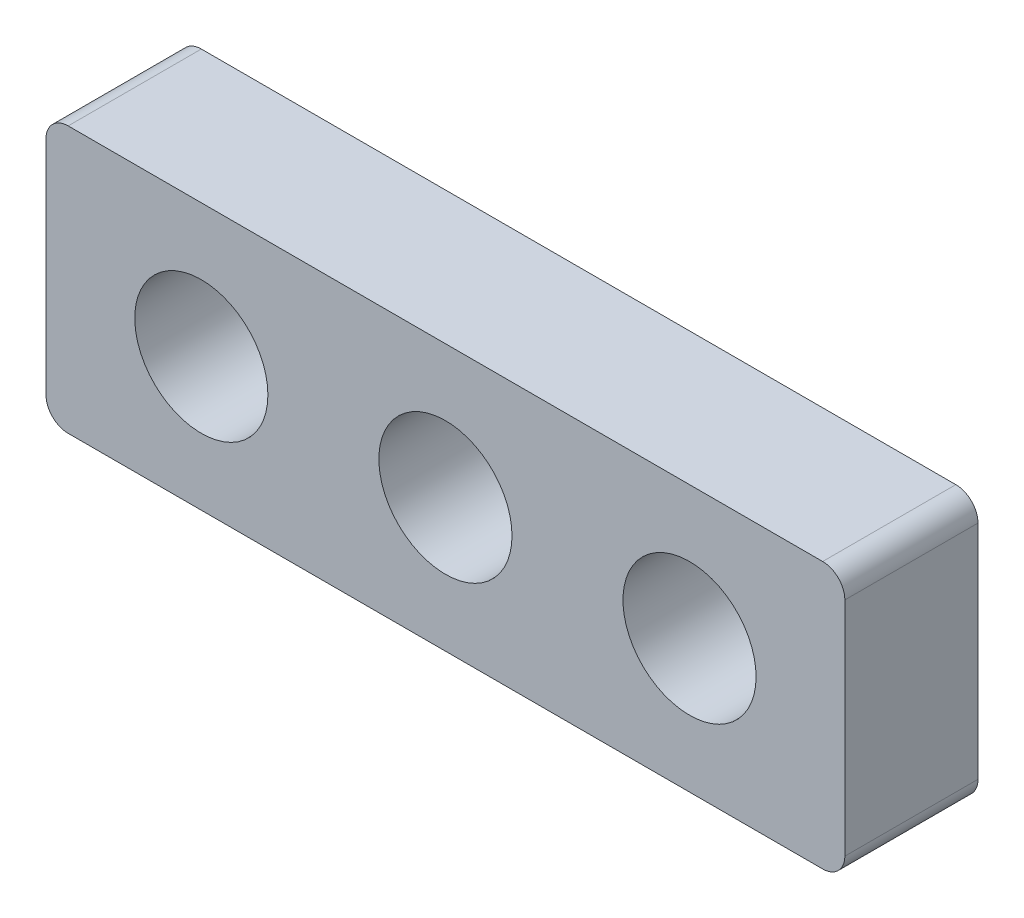
from build123d import *

# Parameters (mm, degrees)
SKETCH_1_W          = 18
SKETCH_1_H          = 6
SKETCH_1_R          = 1.5
EXTRUDE_1_DEPTH     = 1.5
SKETCH_2_R          = 1.5
CUT_EXTRUDE_1_DEPTH = 10.949874371
FILLET_1_R          = 0.5


with BuildPart() as part:
    # 草图1 → 凸台-拉伸1 (new, symmetric)
    with BuildSketch(Plane.XY):
        Rectangle(SKETCH_1_W, SKETCH_1_H)
        Circle(SKETCH_1_R, mode=Mode.SUBTRACT)
    extrude(amount=EXTRUDE_1_DEPTH, both=True)

    # 草图2 → 切除-拉伸1 (cut, through all)
    with BuildSketch(Plane.XY.offset(1.5)):
        with Locations((-5.5, 0)):
            Circle(SKETCH_2_R)
        with Locations((5.5, 0)):
            Circle(SKETCH_2_R)
    extrude(amount=-CUT_EXTRUDE_1_DEPTH, mode=Mode.SUBTRACT)

    # 圆角1
    fillet_1_edges = [part.edges().sort_by_distance(p)[0] for p in [
        (-9, 3, 0),
        (9, 3, 0),
        (9, -3, 0),
        (-9, -3, 0),
    ]]
    fillet(fillet_1_edges, radius=FILLET_1_R)


solid = part.part
